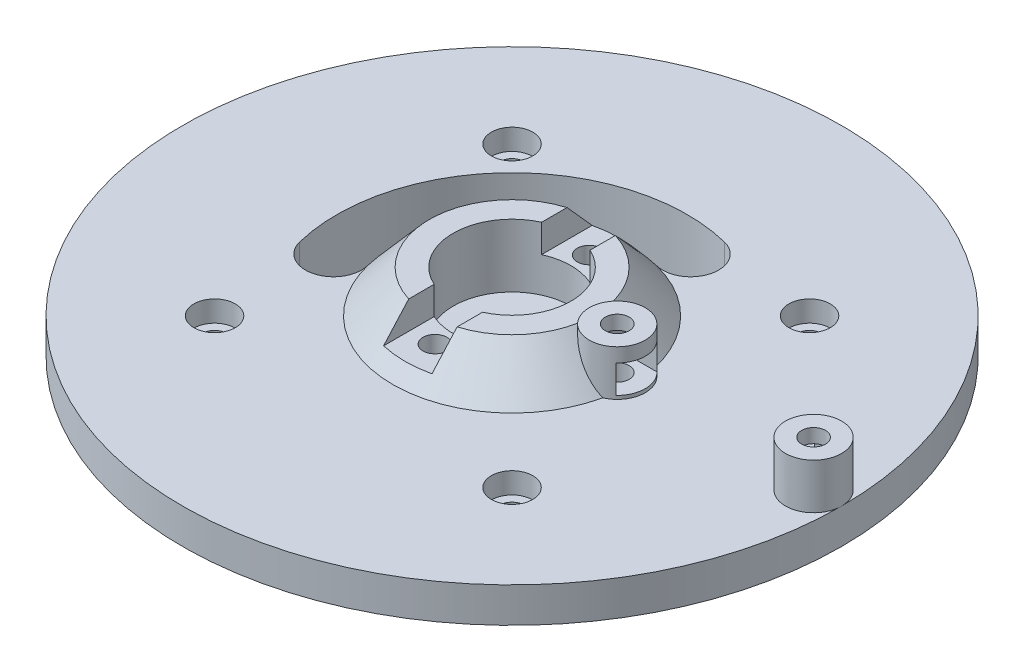
from build123d import *

# Parameters (mm, degrees)
SKETCH3_R               = 1.7
CUT_EXTRUDE1_DEPTH      = 68.372101051
CIRPATTERN1_COUNT       = 4
BOSS_EXTRUDE1_DEPTH     = 11
SKETCH6_R               = 8.4
CUT_EXTRUDE2_DEPTH      = 3
SKETCH7_W               = 6.9
SKETCH7_H               = 40
CUT_EXTRUDE3_DEPTH      = 4
SKETCH8_R               = 1.7
CUT_EXTRUDE4_DEPTH      = 68.727394753
SKETCH9_R               = 4
BOSS_EXTRUDE2_DEPTH     = 6.5
SKETCH10_R              = 1.7
CUT_EXTRUDE5_DEPTH      = 69.733179761
CUT_EXTRUDE6_DEPTH      = 1
CUT_EXTRUDE6_DEPTH_BACK = 3
SKETCH12_R              = 2.95
CUT_EXTRUDE7_DEPTH      = 3
CIRPATTERN2_COUNT       = 4
CUT_EXTRUDE8_DEPTH      = 3


with BuildPart() as part:
    # Sketch1 → Revolve1 (revolve)
    with BuildSketch(Plane.XY):
        Polygon((25, 0), (47, 0), (47, -5), (35, -5), (35, -11), (25, -11), align=None)
    revolve(axis=Axis((0, -62.255842479, 0), (0, 1, 0)))

    # Sketch3 → Cut-Extrude1 (cut, symmetric)
    with BuildSketch(Plane(origin=(0, 0, 0), x_dir=(1, 0, 0), z_dir=(0, 1, 0))):
        with Locations(Location((21.213203436, 21.213203436, 0), (0, 0, 180))):
            Circle(SKETCH3_R)
    cut_extrude1 = extrude(amount=CUT_EXTRUDE1_DEPTH, both=True, mode=Mode.SUBTRACT)

    # CirPattern1: Cut-Extrude1 ×4 about axis
    cirpattern1_axis = Axis((0, 0, 0), (0, 1, 0))
    for i in range(1, CIRPATTERN1_COUNT):
        add(cut_extrude1.rotate(cirpattern1_axis, i * 360 / CIRPATTERN1_COUNT), mode=Mode.SUBTRACT)

    # Sketch4 → Boss-Extrude1 (add, through all)
    with BuildSketch(Plane(origin=(0, 0, 0), x_dir=(1, 0, 0), z_dir=(0, 1, 0))):
        with BuildLine():
            ThreePointArc((4.118263467, 16.493632287), (-12.020815273, 12.020815288), (-16.493632292, -4.118263447))
            ThreePointArc((-16.493632292, -4.118263447), (-19.405482869, -8.968121999), (-24.255341261, -6.056271155))
            ThreePointArc((-24.255341261, -6.056271155), (17.677669687, -17.677669372), (6.056270723, 24.255341369))
            ThreePointArc((6.056270723, 24.255341369), (8.968122055, 19.405483096), (4.118263467, 16.493632287))
        make_face()
    extrude(amount=-BOSS_EXTRUDE1_DEPTH)

    # Sketch5 → Revolve2 (revolve)
    with BuildSketch(Plane(origin=(0, 0, 0), x_dir=(0, 0, -1), z_dir=(1, 0, 0)), mode=Mode.PRIVATE) as revolve2_sk:
        Polygon((-8.4, 0), (-8.4, 6), (-11.8, 6), (-17, 0), align=None)
    revolve(revolve2_sk.sketch.rotate(Axis((0, 0, 0), (0, -1, 0)), 194.019424572), axis=Axis((0, 0, 0), (0, -1, 0)))

    # Sketch6 → Cut-Extrude2 (cut)
    with BuildSketch(Plane(origin=(0, 0, 0), x_dir=(1, 0, 0), z_dir=(0, 1, 0))):
        with Locations(Location((0, 0, 0), (0, 0, 270))):
            Circle(SKETCH6_R)
    extrude(amount=-CUT_EXTRUDE2_DEPTH, mode=Mode.SUBTRACT)

    # Sketch7 → Cut-Extrude3 (cut)
    with BuildSketch(Plane(origin=(0, 6, 0), x_dir=(1, 0, 0), z_dir=(0, 1, 0))):
        Rectangle(SKETCH7_W, SKETCH7_H)
    extrude(amount=-CUT_EXTRUDE3_DEPTH, mode=Mode.SUBTRACT)

    # Sketch8 → Cut-Extrude4 (cut, through all)
    with BuildSketch(Plane(origin=(0, 2, 0), x_dir=(1, 0, 0), z_dir=(0, 1, 0))):
        with Locations(Location((0, 11, 0), (0, 0, 270))):
            Circle(SKETCH8_R)
        with Locations(Location((0, -11, 0), (0, 0, 270))):
            Circle(SKETCH8_R)
    extrude(amount=-CUT_EXTRUDE4_DEPTH, mode=Mode.SUBTRACT)

    # Sketch9 → Boss-Extrude2 (add)
    with BuildSketch(Plane(origin=(0, 0, 0), x_dir=(1, 0, 0), z_dir=(0, 1, 0))):
        with Locations((43, 0)):
            Circle(SKETCH9_R)
        with Locations(Location((15, 0, 0), (0, 0, 293.578178493))):
            Circle(SKETCH9_R)
    extrude(amount=BOSS_EXTRUDE2_DEPTH)

    # Sketch10 → Cut-Extrude5 (cut, through all)
    with BuildSketch(Plane(origin=(0, 6.5, 0), x_dir=(1, 0, 0), z_dir=(0, 1, 0))):
        with Locations(Location((15, 0, 0), (0, 0, 180))):
            Circle(SKETCH10_R)
        with Locations(Location((43, 0, 0), (0, 0, 180))):
            Circle(SKETCH10_R)
    extrude(amount=-CUT_EXTRUDE5_DEPTH, mode=Mode.SUBTRACT)

    # Sketch11 → Cut-Extrude6 (cut, two sides: drawn at the far end of the back side and taken through both)
    with BuildSketch(Plane(origin=(0, 3.5, 0), x_dir=(1, 0, 0), z_dir=(0, 1, 0)).offset(-CUT_EXTRUDE6_DEPTH_BACK)):
        Polygon((18.35, 0), (16.675, 2.901185103), (13.325, 2.901185103), (11.65, 0), (13.325, -2.901185103), (16.675, -2.901185103), align=None)
        Polygon((41.325, 2.901185103), (44.675, 2.901185103), (46.35, 0), (44.675, -2.901185103), (41.325, -2.901185103), (39.65, 0), align=None)
        Polygon((16.675, -2.901185103), (18.35, 0), (16.675, 2.901185103), (41.325, 2.901185103), (39.65, 0), (41.325, -2.901185103), align=None)
    extrude(amount=CUT_EXTRUDE6_DEPTH + CUT_EXTRUDE6_DEPTH_BACK, mode=Mode.SUBTRACT)

    # Sketch12 → Cut-Extrude7 (cut)
    with BuildSketch(Plane(origin=(0, 0, 0), x_dir=(1, 0, 0), z_dir=(0, 1, 0))):
        with Locations(Location((-21.213203436, 21.213203436, 0), (0, 0, 180))):
            Circle(SKETCH12_R)
    cut_extrude7 = extrude(amount=-CUT_EXTRUDE7_DEPTH, mode=Mode.SUBTRACT)

    # CirPattern2: Cut-Extrude7 ×4 about axis
    cirpattern2_axis = Axis((0, 0, 0), (0, 1, 0))
    for i in range(1, CIRPATTERN2_COUNT):
        add(cut_extrude7.rotate(cirpattern2_axis, i * 360 / CIRPATTERN2_COUNT), mode=Mode.SUBTRACT)

    # Sketch14 → Cut-Extrude8 (cut)
    with BuildSketch(Plane.XZ.offset(11)):
        Polygon((-1.675, 13.901185103), (1.675, 13.901185103), (3.35, 11), (1.675, 8.098814897), (-1.675, 8.098814897), (-3.35, 11), align=None)
        Polygon((-1.675, -8.098814897), (-3.35, -11), (-1.675, -13.901185103), (1.675, -13.901185103), (3.35, -11), (1.675, -8.098814897), align=None)
    extrude(amount=-CUT_EXTRUDE8_DEPTH, mode=Mode.SUBTRACT)


solid = part.part
